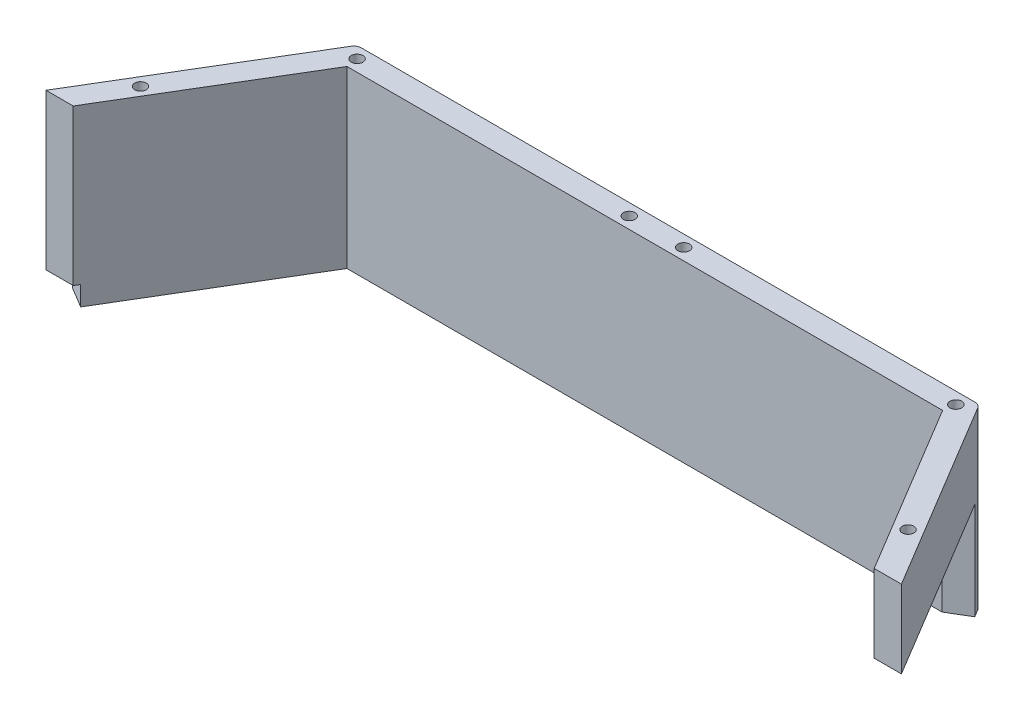
from build123d import *

# Parameters (mm, degrees)
BOSS_EXTRUDE1_DEPTH = 22.5
SKETCH2_R           = 1.5
CUT_EXTRUDE1_DEPTH  = 5
FILLET1_R           = 2
SKETCH4_W           = 55
SKETCH4_H           = 25
CUT_EXTRUDE3_DEPTH  = 10
SKETCH5_W           = 5
SKETCH5_H           = 5
CUT_EXTRUDE4_DEPTH  = 10


with BuildPart() as part:
    # Sketch1 → Boss-Extrude1 (new, symmetric)
    with BuildSketch(Plane(origin=(0, 0, 0), x_dir=(1, 0, 0), z_dir=(0, 1, 0))):
        Polygon((-110, 0), (-80, 50), (80, 50), (110, 0), (103, 0), (76.6, 44), (-76.6, 44), (-103, 0), align=None)
    extrude(amount=BOSS_EXTRUDE1_DEPTH, both=True)

    # Sketch2 → Cut-Extrude1 (cut)
    with BuildSketch(Plane(origin=(0, 22.5, 0), x_dir=(1, 0, 0), z_dir=(0, 1, 0))):
        with Locations(Location((-98.701428863, 13, 0), (0, 0, 270))):
            Circle(SKETCH2_R)
        with Locations(Location((-77, 47, 0), (0, 0, 270))):
            Circle(SKETCH2_R)
        with Locations(Location((-7, 47, 0), (0, 0, 270))):
            Circle(SKETCH2_R)
        with Locations(Location((7, 47, 0), (0, 0, 90))):
            Circle(SKETCH2_R)
        with Locations(Location((77, 47, 0), (0, 0, 90))):
            Circle(SKETCH2_R)
        with Locations(Location((98.701428863, 13, 0), (0, 0, 90))):
            Circle(SKETCH2_R)
    extrude(amount=-CUT_EXTRUDE1_DEPTH, mode=Mode.SUBTRACT)

    # Fillet1
    fillet1_edges = [part.edges().sort_by_distance(p)[0] for p in [
        (-80, 0, -50),
        (80, 0, -50),
    ]]
    fillet(fillet1_edges, radius=FILLET1_R)

    # Sketch4 → Cut-Extrude3 (cut)
    with BuildSketch(Plane(origin=(80.882352941, 0, -48.529411765), x_dir=(-0.5144957554275265, 0, -0.8574929257125443), z_dir=(0.8574929257125443, 0, -0.5144957554275265))):
        with Locations((-29.094533097, -10)):
            Rectangle(SKETCH4_W, SKETCH4_H)
    extrude(amount=-CUT_EXTRUDE3_DEPTH, mode=Mode.SUBTRACT)

    # Sketch5 → Cut-Extrude4 (cut)
    with BuildSketch(Plane(origin=(-75.735294118, 0, -45.441176471), x_dir=(0.5144957554275261, 0, -0.8574929257125445), z_dir=(0.8574929257125444, 0, 0.514495755427526))):
        with Locations((-54.094533097, -20)):
            Rectangle(SKETCH5_W, SKETCH5_H)
    extrude(amount=-CUT_EXTRUDE4_DEPTH, mode=Mode.SUBTRACT)


solid = part.part
